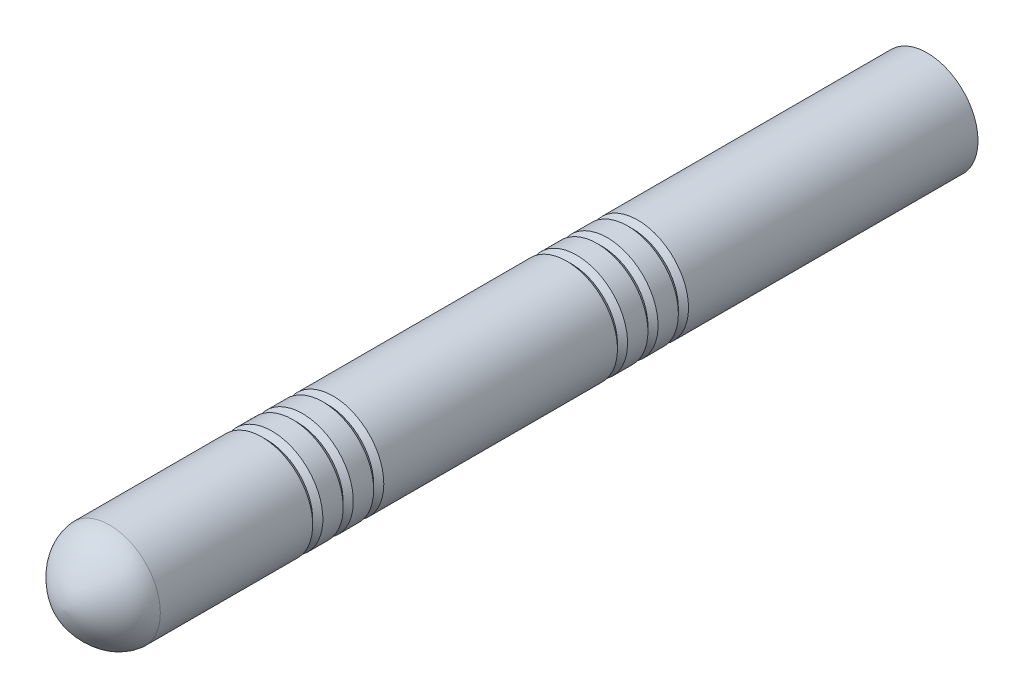
from build123d import *

# Parameters (mm, degrees)
SKETCH_1_R             = 5
EXTRUDE_1_DEPTH        = 80.5
PATTERN_LINEAR_1_COUNT = 2
PATTERN_LINEAR_1_PITCH = 30
HOLE_WIZARD_M8_1_D     = 6.8
HOLE_WIZARD_M8_1_DEPTH = 67.07
HOLE_WIZARD_M8_1_TIP   = 1.962990915


with BuildPart() as part:
    # 草图1 → 凸台-拉伸1 (new body)
    with BuildSketch(Plane.XY):
        Circle(SKETCH_1_R)
    extrude(amount=EXTRUDE_1_DEPTH)

    # 草图2 → 切除-旋转1 (revolve, cut)
    with BuildSketch(Plane(origin=(0, 0, 0), x_dir=(0, 0, -1), z_dir=(1, 0, 0)), mode=Mode.PRIVATE) as cut_revolve_1_sk:
        Polygon((-28.5, 5), (-29, 4.5), (-29.5, 5), align=None)
    cut_revolve_1 = revolve(cut_revolve_1_sk.sketch.rotate(Axis((0, 0, 95.745641227), (0, 0, -1)), 90), axis=Axis((0, 0, 95.745641227), (0, 0, -1)), mode=Mode.SUBTRACT)

    # 草图4 → 切除-旋转2 (revolve, cut)
    with BuildSketch(Plane(origin=(0, 0, 0), x_dir=(0, 0, -1), z_dir=(1, 0, 0)), mode=Mode.PRIVATE) as cut_revolve_2_sk:
        Polygon((-31.5, 5), (-32, 4.5), (-32.5, 5), align=None)
        Polygon((-34.5, 5), (-35, 4.5), (-35.5, 5), align=None)
    cut_revolve_2 = revolve(cut_revolve_2_sk.sketch.rotate(Axis((0, 0, -1.972626415), (0, 0, 1)), 90), axis=Axis((0, 0, -1.972626415), (0, 0, 1)), mode=Mode.SUBTRACT)

    # 阵列(线性)1: 切除-旋转1, 切除-旋转2 ×2
    with Locations(*[(0, 0, i * PATTERN_LINEAR_1_PITCH) for i in range(1, PATTERN_LINEAR_1_COUNT)]):
        add(cut_revolve_1, mode=Mode.SUBTRACT)
        add(cut_revolve_2, mode=Mode.SUBTRACT)

    # 草图5 → 旋转2 (revolve)
    with BuildSketch(Plane(origin=(0, 0, 0), x_dir=(0, 0, -1), z_dir=(1, 0, 0)), mode=Mode.PRIVATE) as revolve_2_sk:
        with BuildLine():
            Line((-80.5, 5), (-80.5, 0))
            Line((-80.5, 0), (-85, 0))
            add(Edge.make_bspline(
                [(-80.5, 5), (-81.808902232, 4.887546308), (-83.760685611, 3.318595148), (-84.908352583, 1.178697403), (-85, 0)],
                knots=[0, 0, 0, 0, 0.52200898, 1, 1, 1, 1], degree=3))
        make_face()
    revolve(revolve_2_sk.sketch.rotate(Axis((0, 0, 87.782786163), (0, 0, -1)), 270), axis=Axis((0, 0, 87.782786163), (0, 0, -1)))

    # M8 螺纹孔1
    with Locations(Plane(origin=(0, 0, 0), x_dir=(-1, 0, 0), z_dir=(0, 0, -1))):
        with Locations((0, 0)):
            Hole(HOLE_WIZARD_M8_1_D / 2, depth=HOLE_WIZARD_M8_1_DEPTH)
            with Locations((0, 0, -(HOLE_WIZARD_M8_1_DEPTH + HOLE_WIZARD_M8_1_TIP / 2))):  # 120° drill point
                Cone(0, HOLE_WIZARD_M8_1_D / 2, HOLE_WIZARD_M8_1_TIP, mode=Mode.SUBTRACT)


solid = part.part
